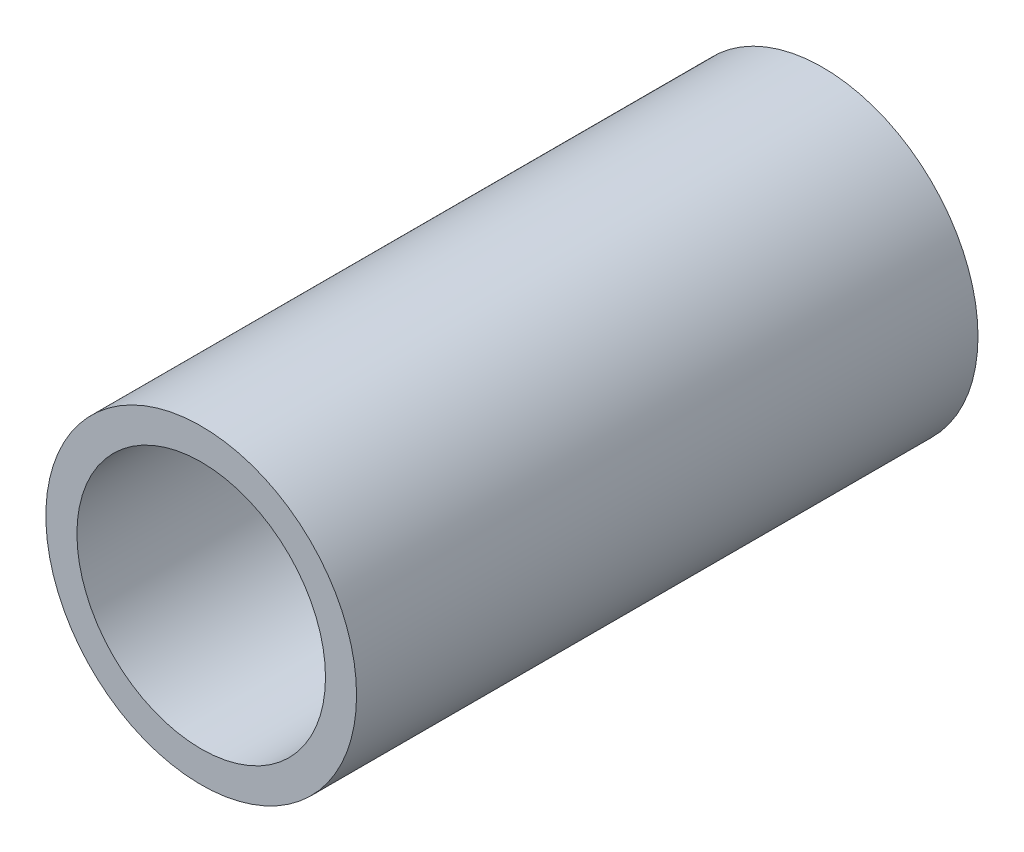
from build123d import *

# Parameters (mm, degrees)
ESBO_O1_R                = 12.5
ESBO_O1_R_2              = 10
RESSALTO_EXTRUS_O1_DEPTH = 50


with BuildPart() as part:
    # Esboço1 → Ressalto-extrusão1 (new body)
    with BuildSketch(Plane.XY):
        Circle(ESBO_O1_R)
        Circle(ESBO_O1_R_2, mode=Mode.SUBTRACT)
    extrude(amount=RESSALTO_EXTRUS_O1_DEPTH)


solid = part.part
